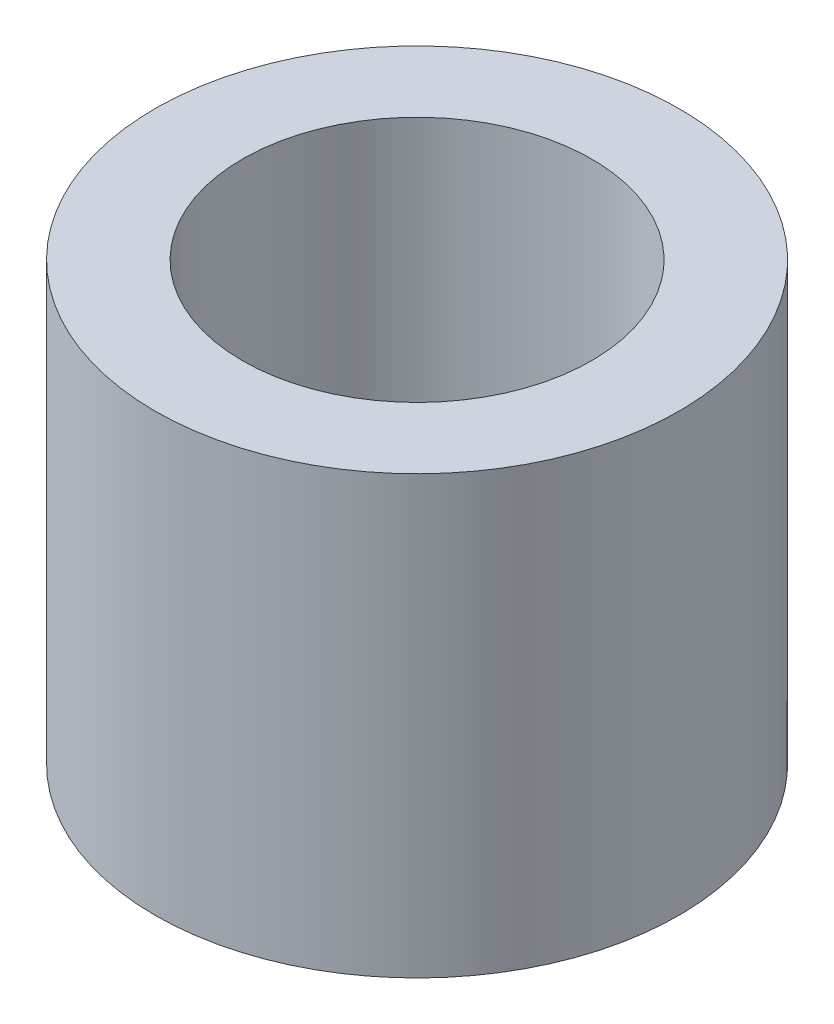
from build123d import *

# Parameters (mm, degrees)
SKETCH2_R      = 6
SKETCH2_R_2    = 4
EXTRUDE1_DEPTH = 10


with BuildPart() as part:
    # Sketch2 → Extrude1 (new body)
    with BuildSketch(Plane(origin=(0, 0, 0), x_dir=(1, 0, 0), z_dir=(0, 1, 0))):
        with Locations(Location((0, 0, 0), (0, 0, 270))):
            Circle(SKETCH2_R)
        with Locations(Location((0, 0, 0), (0, 0, 270))):
            Circle(SKETCH2_R_2, mode=Mode.SUBTRACT)
    extrude(amount=EXTRUDE1_DEPTH)


solid = part.part
